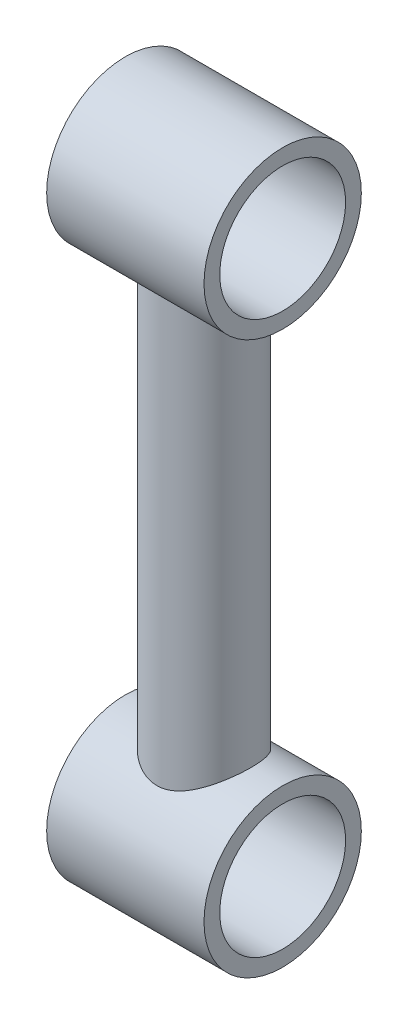
from build123d import *

# Parameters (mm, degrees)
SKETCH_1_R           = 50
SKETCH_1_R_2         = 40
EXTRUDE_1_DEPTH      = 50
EXTRUDE_2_REACH      = 238.422
EXTRUDE_2_END_RADIUS = 50
SKETCH_2_R           = 30


with BuildPart() as part:
    # 草图1 → 凸台-拉伸1 (new, symmetric)
    with BuildSketch(Plane(origin=(0, 0, 0), x_dir=(0, 0, -1), z_dir=(1, 0, 0))):
        Circle(SKETCH_1_R)
        Circle(SKETCH_1_R_2, mode=Mode.SUBTRACT)
    extrude_1 = extrude(amount=EXTRUDE_1_DEPTH, both=True)

    # 凸台-拉伸2: up to this cylinder (the profile starts outside it)
    extrude_2_end = Plane(origin=(0, 0, 0), z_dir=(1, 0, 0)) * Cylinder(EXTRUDE_2_END_RADIUS, 577.844, mode=Mode.PRIVATE)
    # 草图2 → 凸台-拉伸2 (add, up to the surface)
    with BuildSketch(Plane(origin=(0, -175.6, 0), x_dir=(1, 0, 0), z_dir=(0, 1, 0)), mode=Mode.PRIVATE) as extrude_2_sk1:
        with Locations(Location((0, 0, 0), (0, 0, 90))):
            Circle(SKETCH_2_R)
    extrude_2_tool1 = extrude(extrude_2_sk1.sketch, amount=EXTRUDE_2_REACH, mode=Mode.PRIVATE) - extrude_2_end
    extrude_2 = extrude_2_tool1.solids().sort_by_distance((0, -175.6, 0))[0]
    add(extrude_2)

    # 镜向4: 凸台-拉伸2 across plane
    add(extrude_2.mirror(Plane.ZX.offset(-175.6)))

    # 镜向5: 凸台-拉伸1 across plane
    add(extrude_1.mirror(Plane.ZX.offset(-175.6)))


solid = part.part
